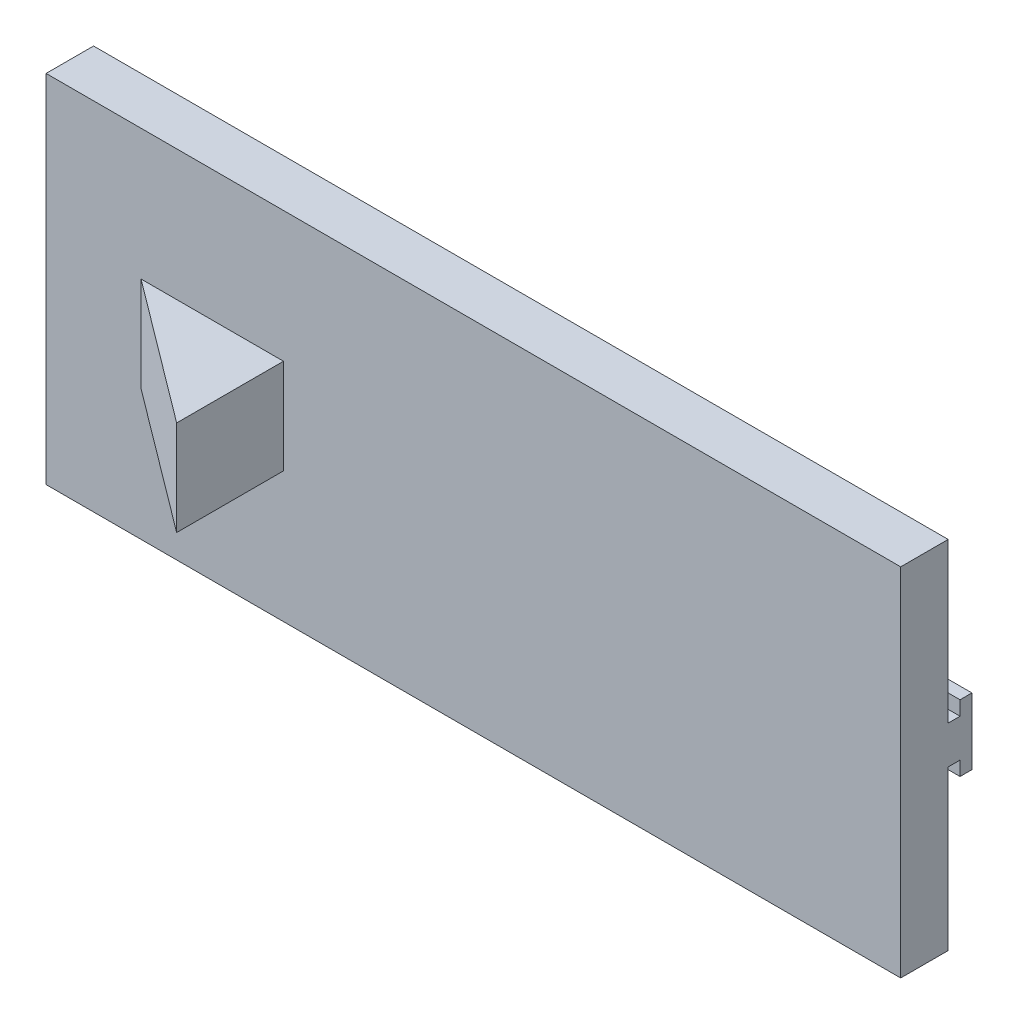
from build123d import *

# Parameters (mm, degrees)
SKETCH1_W                = 457.2
SKETCH1_H                = 190.5
BOSS_EXTRUDE1_DEPTH      = 25.4
SKETCH2_W                = 457.2
SKETCH2_H                = 20.32
BOSS_EXTRUDE2_DEPTH      = 12.7
BOSS_EXTRUDE3_DEPTH      = 7.62
BOSS_EXTRUDE3_DEPTH_BACK = 27.94
SKETCH3_W                = 457.2
SKETCH3_H                = 6.35
BOSS_EXTRUDE5_DEPTH      = 25.4
BOSS_EXTRUDE5_DEPTH_BACK = 25.4


with BuildPart() as part:
    # Sketch1 → Boss-Extrude1 (new body)
    with BuildSketch(Plane.XY):
        Rectangle(SKETCH1_W, SKETCH1_H)
    extrude(amount=BOSS_EXTRUDE1_DEPTH)

    # Sketch2 → Boss-Extrude2 (add)
    with BuildSketch(Plane(origin=(0, 0, 0), x_dir=(-1, 0, 0), z_dir=(0, 0, -1))):
        Rectangle(SKETCH2_W, SKETCH2_H)
    extrude(amount=BOSS_EXTRUDE2_DEPTH)

    # Sketch3 → Boss-Extrude3 (add, two sides: drawn at the far end of the back side and taken through both)
    with BuildSketch(Plane(origin=(0, 10.16, 0), x_dir=(1, 0, 0), z_dir=(0, 1, 0)).offset(-BOSS_EXTRUDE3_DEPTH_BACK)):
        with Locations((0, 9.525)):
            Rectangle(SKETCH3_W, SKETCH3_H)
    extrude(amount=BOSS_EXTRUDE3_DEPTH + BOSS_EXTRUDE3_DEPTH_BACK)

    # Sketch5 → Boss-Extrude5 (add, two sides: drawn at the far end of the back side and taken through both)
    with BuildSketch(Plane(origin=(0, 0, 0), x_dir=(1, 0, 0), z_dir=(0, 1, 0)).offset(-BOSS_EXTRUDE5_DEPTH_BACK)):
        Polygon((-177.8, -25.4), (-101.6, -25.4), (-101.6, -82.55), align=None)
    extrude(amount=BOSS_EXTRUDE5_DEPTH + BOSS_EXTRUDE5_DEPTH_BACK)


solid = part.part
